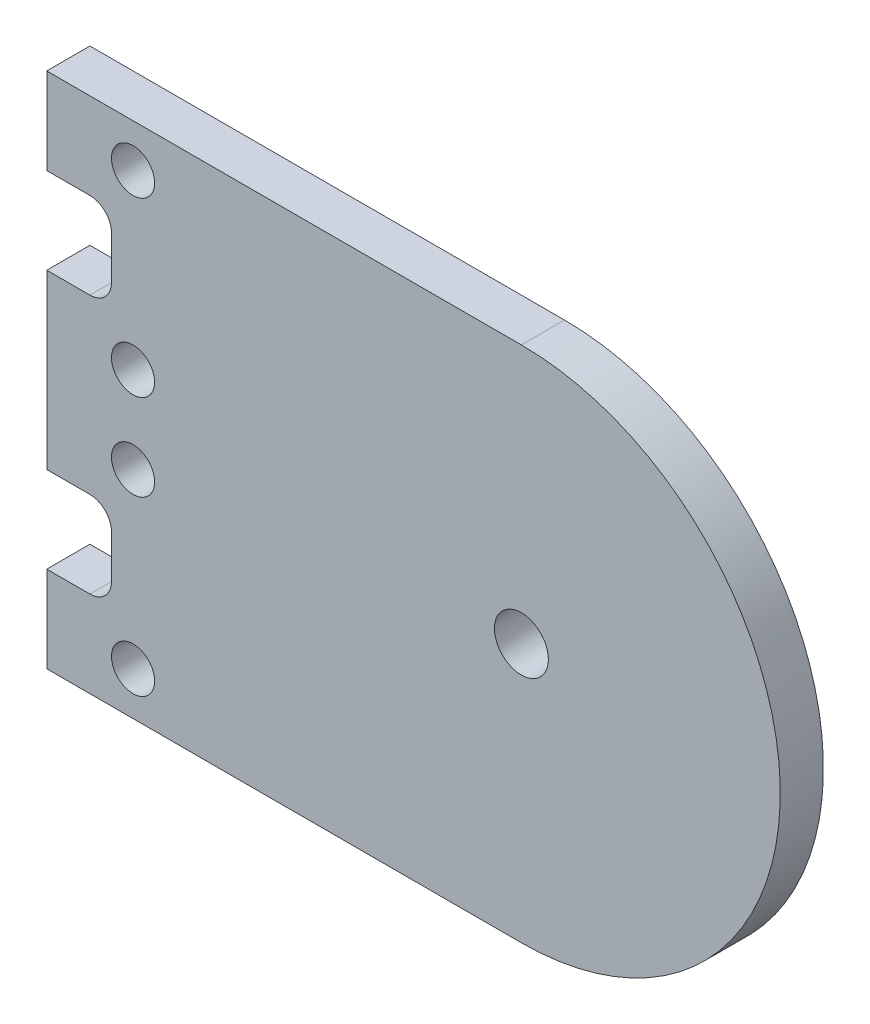
from build123d import *

# Parameters (mm, degrees)
SKETCH_1_R      = 1.25
SKETCH_1_R_2    = 1
EXTRUDE_1_DEPTH = 2


with BuildPart() as part:
    # 草圖1 → 填料-伸長1 (new body)
    with BuildSketch(Plane.XY):
        with BuildLine():
            Line((-38.093061493, 13.879025542), (-16.093061493, 13.879025542))
            ThreePointArc((-16.093061493, 13.879025542), (-4.093061493, 1.879025542), (-16.093061493, -10.120974458))
            Line((-16.093061493, -10.120974458), (-38.093061493, -10.120974458))
            Line((-38.093061493, -10.120974458), (-38.093061493, -6.120974458))
            Line((-38.093061493, -6.120974458), (-36.093061493, -6.120974458))
            ThreePointArc((-36.093061493, -6.120974458), (-35.385954712, -5.828081239), (-35.093061493, -5.120974458))
            Line((-35.093061493, -5.120974458), (-35.093061493, -3.120974458))
            ThreePointArc((-35.093061493, -3.120974458), (-35.385954712, -2.413867677), (-36.093061493, -2.120974458))
            Line((-36.093061493, -2.120974458), (-38.093061493, -2.120974458))
            Line((-38.093061493, -2.120974458), (-38.093061493, 5.879025542))
            Line((-38.093061493, 5.879025542), (-36.093061493, 5.879025542))
            ThreePointArc((-36.093061493, 5.879025542), (-35.385954712, 6.171918761), (-35.093061493, 6.879025542))
            Line((-35.093061493, 6.879025542), (-35.093061493, 8.879025542))
            ThreePointArc((-35.093061493, 8.879025542), (-35.385954712, 9.586132323), (-36.093061493, 9.879025542))
            Line((-36.093061493, 9.879025542), (-38.093061493, 9.879025542))
            Line((-38.093061493, 9.879025542), (-38.093061493, 13.879025542))
        make_face()
        with Locations((-16.093061493, 1.879025542)):
            Circle(SKETCH_1_R, mode=Mode.SUBTRACT)
        with Locations((-34.093061493, 11.879025542)):
            Circle(SKETCH_1_R_2, mode=Mode.SUBTRACT)
        with Locations((-34.093061493, 3.879025542)):
            Circle(SKETCH_1_R_2, mode=Mode.SUBTRACT)
        with Locations((-34.093061493, -8.120974458)):
            Circle(SKETCH_1_R_2, mode=Mode.SUBTRACT)
        with Locations((-34.093061493, -0.120974458)):
            Circle(SKETCH_1_R_2, mode=Mode.SUBTRACT)
    extrude(amount=EXTRUDE_1_DEPTH)


solid = part.part
